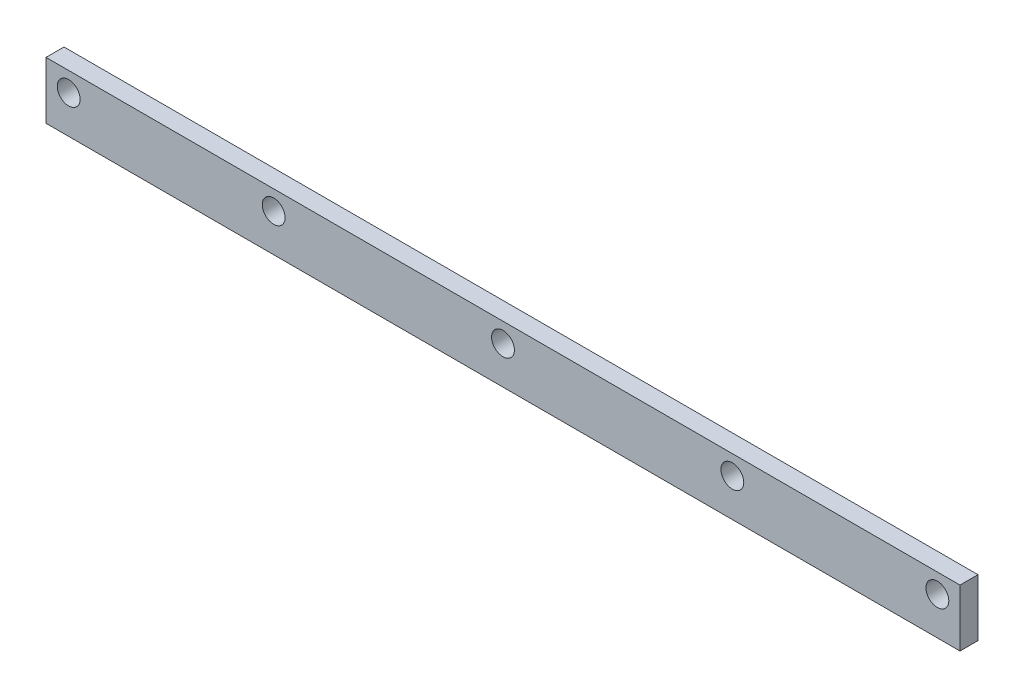
from build123d import *

# Parameters (mm, degrees)
SKETCH2_W           = 203.2
SKETCH2_H           = 12.7
SKETCH2_R           = 2.54
BOSS_EXTRUDE2_DEPTH = 2


with BuildPart() as part:
    # Sketch2 → Boss-Extrude2 (new, symmetric)
    with BuildSketch(Plane.XY):
        with Locations((0, 6.35)):
            Rectangle(SKETCH2_W, SKETCH2_H)
        with Locations((-96.562042846, 8.398896076)):
            Circle(SKETCH2_R, mode=Mode.SUBTRACT)
        with Locations((-50.984733006, 8.398896076)):
            Circle(SKETCH2_R, mode=Mode.SUBTRACT)
        with Locations(Location((96.562042846, 8.398896076, 0), (0, 0, 180))):
            Circle(SKETCH2_R, mode=Mode.SUBTRACT)
        with Locations((0, 8.398896076)):
            Circle(SKETCH2_R, mode=Mode.SUBTRACT)
        with Locations((50.984733006, 8.398896076)):
            Circle(SKETCH2_R, mode=Mode.SUBTRACT)
    extrude(amount=BOSS_EXTRUDE2_DEPTH, both=True)


solid = part.part
